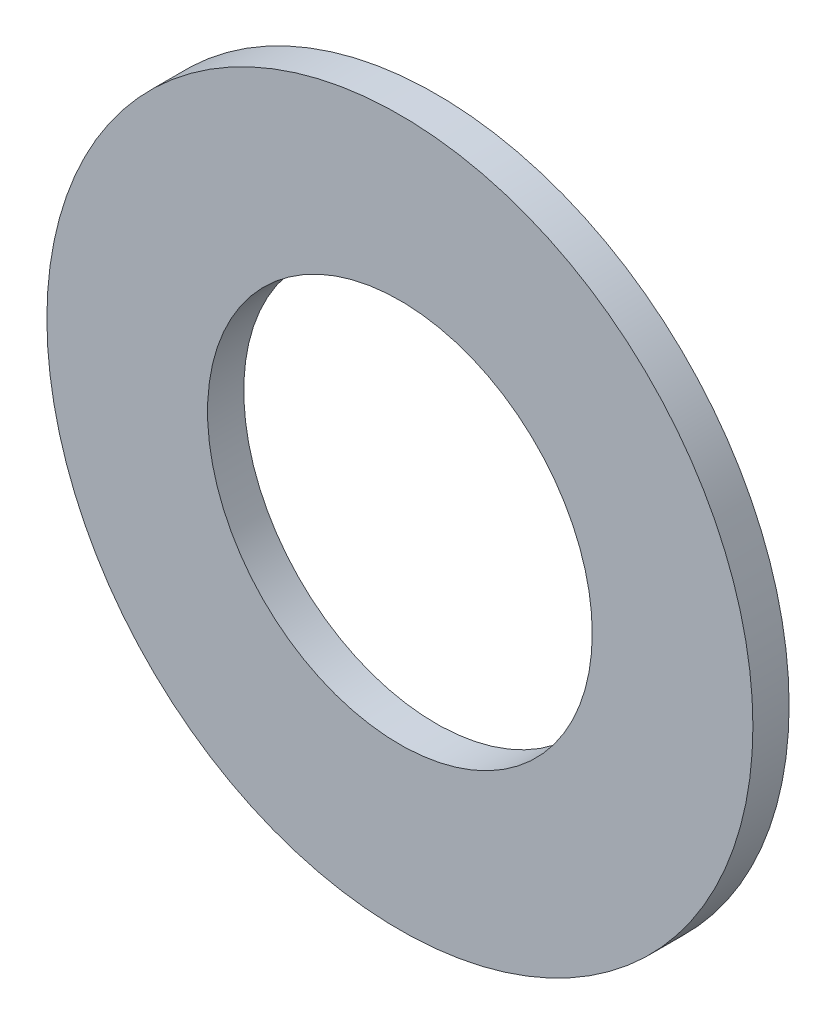
from build123d import *

# Parameters (mm, degrees)
SKETCH3_R           = 78
SKETCH3_R_2         = 42.5
BOSS_EXTRUDE1_DEPTH = 8


with BuildPart() as part:
    # Sketch3 → Boss-Extrude1 (new body)
    with BuildSketch(Plane.XY):
        Circle(SKETCH3_R)
        Circle(SKETCH3_R_2, mode=Mode.SUBTRACT)
    extrude(amount=BOSS_EXTRUDE1_DEPTH)


solid = part.part
